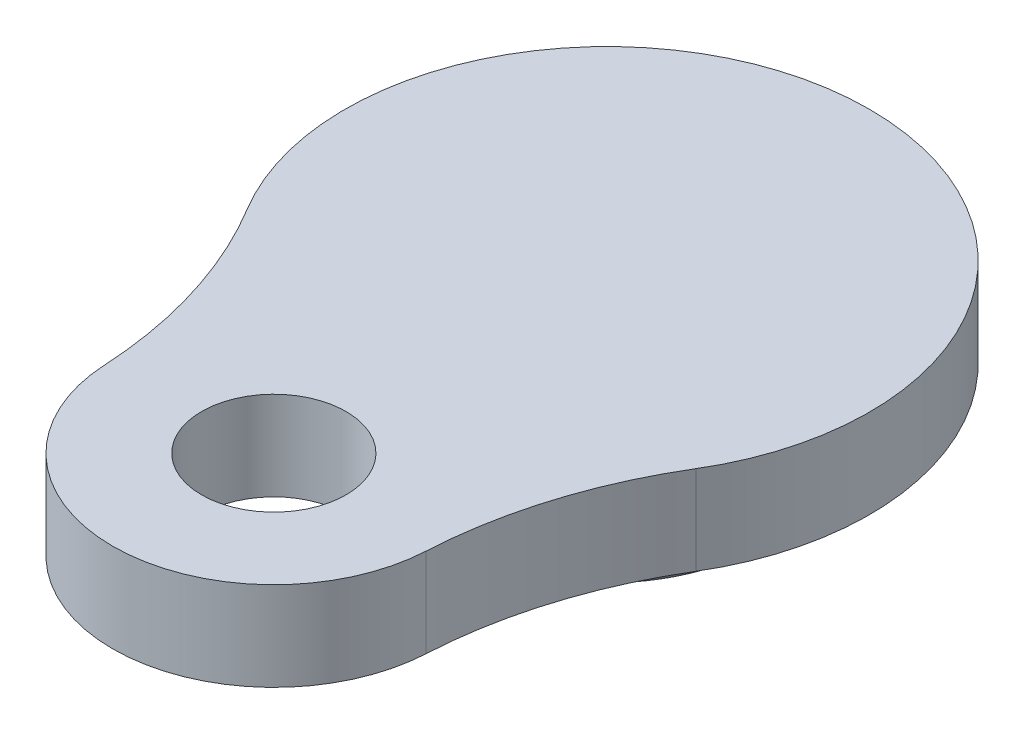
from build123d import *

# Parameters (mm, degrees)
SKETCH1_R           = 1.625
BOSS_EXTRUDE1_DEPTH = 2
SKETCH1_3_R         = 3.9
BOSS_EXTRUDE2_DEPTH = 2
FILLET1_R           = 1


with BuildPart() as part:
    # Sketch1 → Boss-Extrude1 (new body)
    with BuildSketch(Plane(origin=(0, 0, 0), x_dir=(1, 0, 0), z_dir=(0, 1, 0))):
        with BuildLine():
            ThreePointArc((-5.048596372, -3.053141771), (-4.048280274, -5.285374691), (-3.619822402, -7.693676988))
            ThreePointArc((-3.619822402, -7.693676988), (0, -11.125), (3.619822402, -7.693676988))
            ThreePointArc((3.619822402, -7.693676988), (4.048280274, -5.285374691), (5.048596372, -3.053141771))
            ThreePointArc((5.048596372, -3.053141771), (0, 5.9), (-5.048596372, -3.053141771))
        make_face()
        with Locations((0, -7.5)):
            Circle(SKETCH1_R, mode=Mode.SUBTRACT)
    extrude(amount=BOSS_EXTRUDE1_DEPTH)

    # Sketch1<3> → Boss-Extrude2 (add)
    with BuildSketch(Plane(origin=(0, 0, 0), x_dir=(1, 0, 0), z_dir=(0, 1, 0))):
        Circle(SKETCH1_3_R)
    extrude(amount=-BOSS_EXTRUDE2_DEPTH)

    # Fillet1
    fillet1_edges = [part.edges().sort_by_distance(p)[0] for p in [
        (-3.9, -2, 0),
    ]]
    fillet(fillet1_edges, radius=FILLET1_R)


solid = part.part
